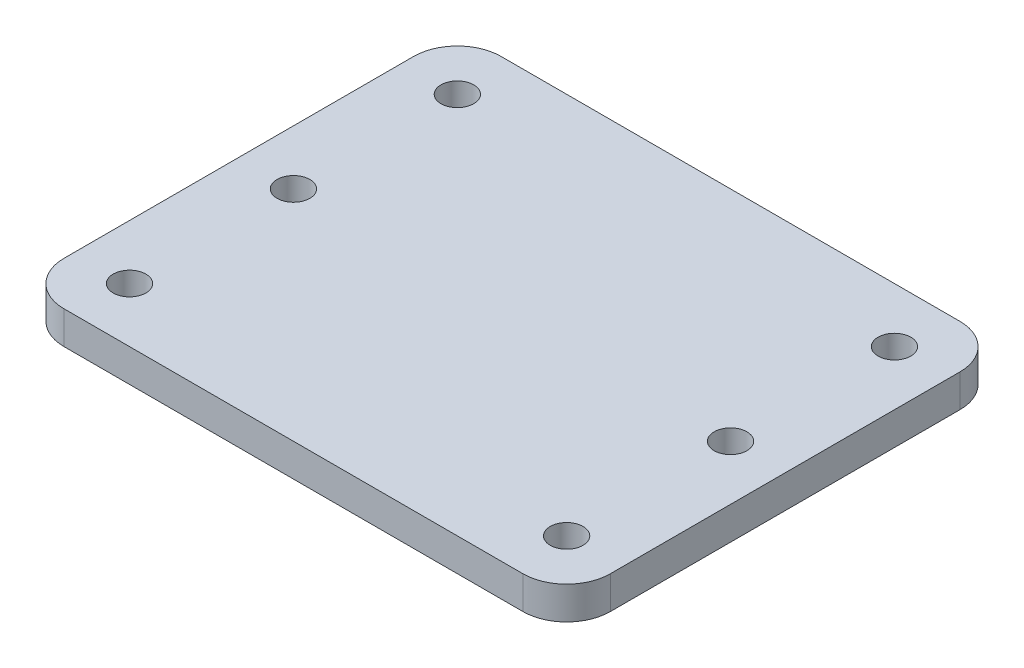
from build123d import *

# Parameters (mm, degrees)
SKETCH1_W           = 50
SKETCH1_H           = 40
BOSS_EXTRUDE1_DEPTH = 3
FILLET1_R           = 4
SKETCH2_R           = 1.5
CUT_EXTRUDE1_DEPTH  = 3
SKETCH3_R           = 1.5
CUT_EXTRUDE3_DEPTH  = 3


with BuildPart() as part:
    # Sketch1 → Boss-Extrude1 (new body)
    with BuildSketch(Plane(origin=(0, 0, 0), x_dir=(1, 0, 0), z_dir=(0, 1, 0))):
        Rectangle(SKETCH1_W, SKETCH1_H)
    extrude(amount=BOSS_EXTRUDE1_DEPTH)

    # Fillet1
    fillet1_edges = [part.edges().sort_by_distance(p)[0] for p in [
        (25, 1.5, 20),
        (-25, 1.5, 20),
        (-25, 1.5, -20),
        (25, 1.5, -20),
    ]]
    fillet(fillet1_edges, radius=FILLET1_R)

    # Sketch2 → Cut-Extrude1 (cut)
    with BuildSketch(Plane(origin=(0, 0, 0), x_dir=(1, 0, 0), z_dir=(0, 1, 0))):
        with Locations(Location((-20, 0, 0), (0, 0, 270))):
            Circle(SKETCH2_R)
        with Locations(Location((20, 0, 0), (0, 0, 270))):
            Circle(SKETCH2_R)
    extrude(amount=CUT_EXTRUDE1_DEPTH, mode=Mode.SUBTRACT)

    # Sketch3 → Cut-Extrude3 (cut)
    with BuildSketch(Plane(origin=(0, 0, 0), x_dir=(1, 0, 0), z_dir=(0, 1, 0))):
        with Locations(Location((-20, -15, 0), (0, 0, 270))):
            Circle(SKETCH3_R)
        with Locations(Location((20, -15, 0), (0, 0, 270))):
            Circle(SKETCH3_R)
        with Locations(Location((20, 15, 0), (0, 0, 270))):
            Circle(SKETCH3_R)
        with Locations(Location((-20, 15, 0), (0, 0, 270))):
            Circle(SKETCH3_R)
    extrude(amount=CUT_EXTRUDE3_DEPTH, mode=Mode.SUBTRACT)


solid = part.part
